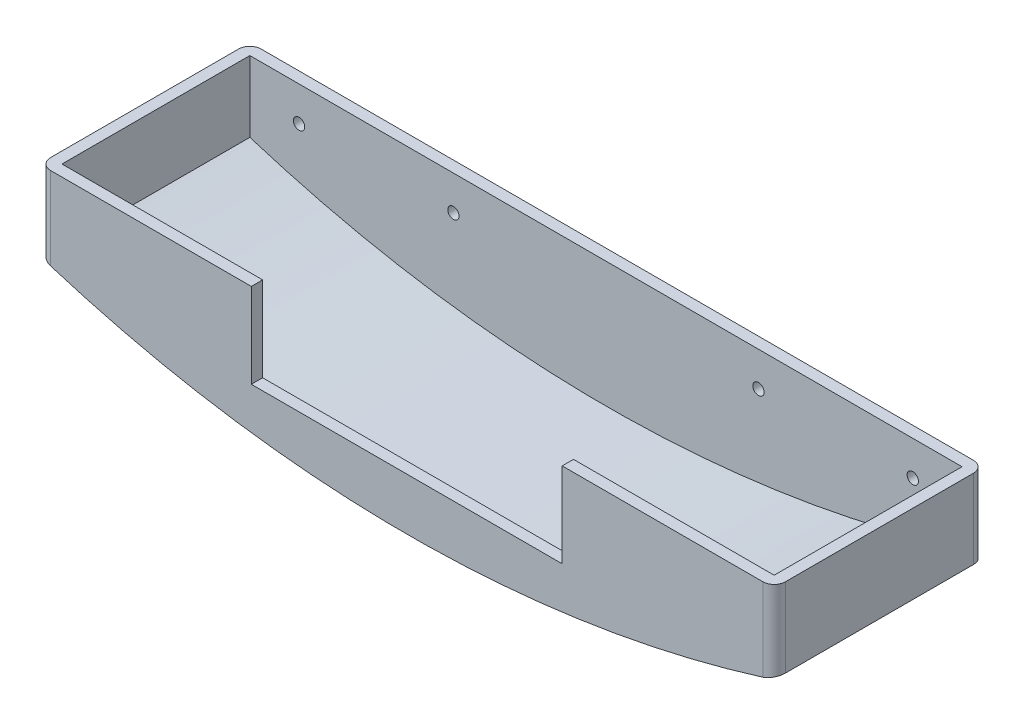
from build123d import *

# Parameters (mm, degrees)
BOSS_EXTRUDE1_DEPTH = 37.24
SHELL1_T            = -2
SKETCH2_W           = 55
SKETCH2_H           = 15
CUT_EXTRUDE1_DEPTH  = 10
SKETCH3_R           = 1
CUT_EXTRUDE2_DEPTH  = 12
FILLET1_R           = 2


with BuildPart() as part:
    # Sketch1 → Boss-Extrude1 (new body)
    with BuildSketch(Plane.XY):
        with BuildLine():
            Line((65, 0), (-65, 0))
            Line((-65, 0), (-65, -14))
            ThreePointArc((-65, -14), (0, -24.210505724), (65, -14))
            Line((65, -14), (65, 0))
        make_face()
    extrude(amount=-BOSS_EXTRUDE1_DEPTH)

    # Shell1
    shell1_openings = [part.faces().sort_by_distance(p)[0] for p in [
        (0, 0, -18.62),
    ]]
    offset(amount=SHELL1_T, openings=shell1_openings, kind=Kind.INTERSECTION)

    # Sketch2 → Cut-Extrude1 (cut)
    with BuildSketch(Plane.XY):
        with Locations((0, -7.5)):
            Rectangle(SKETCH2_W, SKETCH2_H)
    extrude(amount=-CUT_EXTRUDE1_DEPTH, mode=Mode.SUBTRACT)

    # Sketch3 → Cut-Extrude2 (cut)
    with BuildSketch(Plane(origin=(0, 0, -37.24), x_dir=(-1, 0, 0), z_dir=(0, 0, -1))):
        with Locations((-54.285626074, -6.1)):
            Circle(SKETCH3_R)
        with Locations((-26.985626074, -6.1)):
            Circle(SKETCH3_R)
        with Locations((54.285626074, -6.1)):
            Circle(SKETCH3_R)
        with Locations((26.985626074, -6.1)):
            Circle(SKETCH3_R)
    extrude(amount=-CUT_EXTRUDE2_DEPTH, mode=Mode.SUBTRACT)

    # Fillet1
    fillet1_edges = [part.edges().sort_by_distance(p)[0] for p in [
        (65, -7, -37.24),
        (-65, -7, -37.24),
        (65, -7, 0),
        (-65, -7, 0),
    ]]
    fillet(fillet1_edges, radius=FILLET1_R)


solid = part.part
